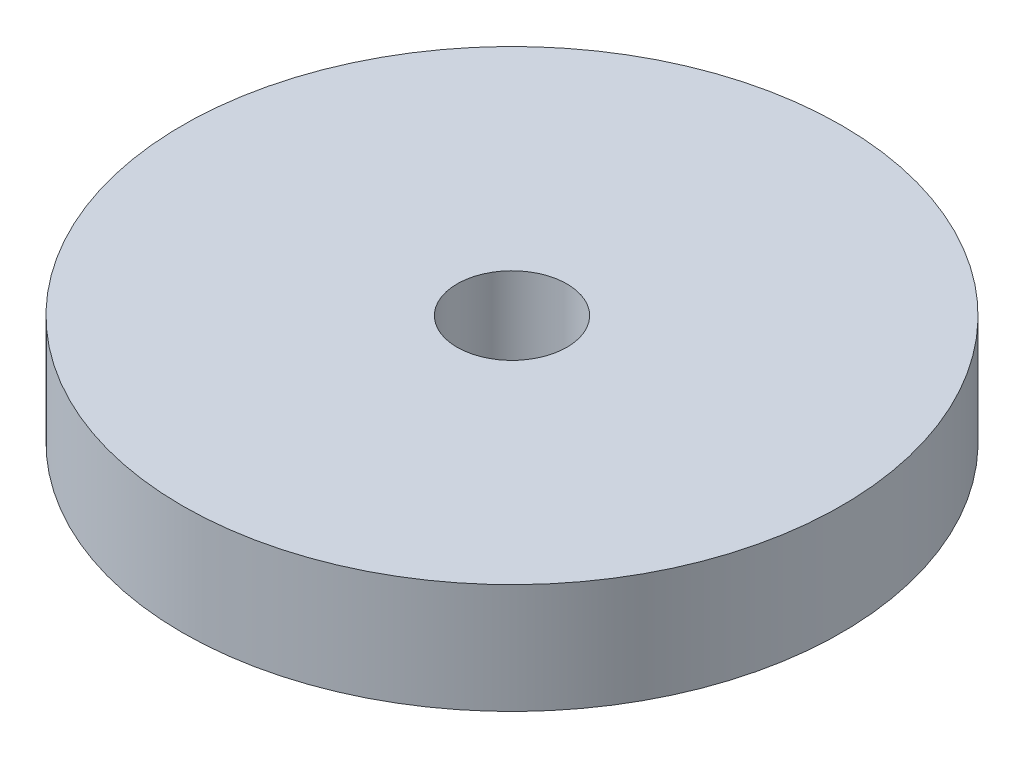
from build123d import *

# Parameters (mm, degrees)
BOSS_EXTRUDE1_DEPTH      = 25
BOSS_EXTRUDE1_DEPTH_BACK = 25
SKETCH1_R                = 150
CUT_EXTRUDE2_DEPTH       = 214.600093633
CUT_EXTRUDE2_DEPTH_BACK  = 214.600093633
SKETCH2_R                = 25


with BuildPart() as part:
    # Sketch1 → Boss-Extrude1 (new, two sides: drawn at the far end of the back side and taken through both)
    with BuildSketch(Plane(origin=(0, 0, 0), x_dir=(1, 0, 0), z_dir=(0, 1, 0)).offset(-BOSS_EXTRUDE1_DEPTH_BACK)):
        with Locations(Location((0, 0, 0), (0, 0, 270))):
            Circle(SKETCH1_R)
    extrude(amount=BOSS_EXTRUDE1_DEPTH + BOSS_EXTRUDE1_DEPTH_BACK)

    # Sketch2 → Cut-Extrude2 (cut, two sides: drawn at the far end of the back side and taken through both)
    with BuildSketch(Plane(origin=(0, 0, 0), x_dir=(1, 0, 0), z_dir=(0, 1, 0)).offset(-CUT_EXTRUDE2_DEPTH_BACK)):
        with Locations(Location((0, 0, 0), (0, 0, 270))):
            Circle(SKETCH2_R)
    extrude(amount=CUT_EXTRUDE2_DEPTH + CUT_EXTRUDE2_DEPTH_BACK, mode=Mode.SUBTRACT)


solid = part.part
